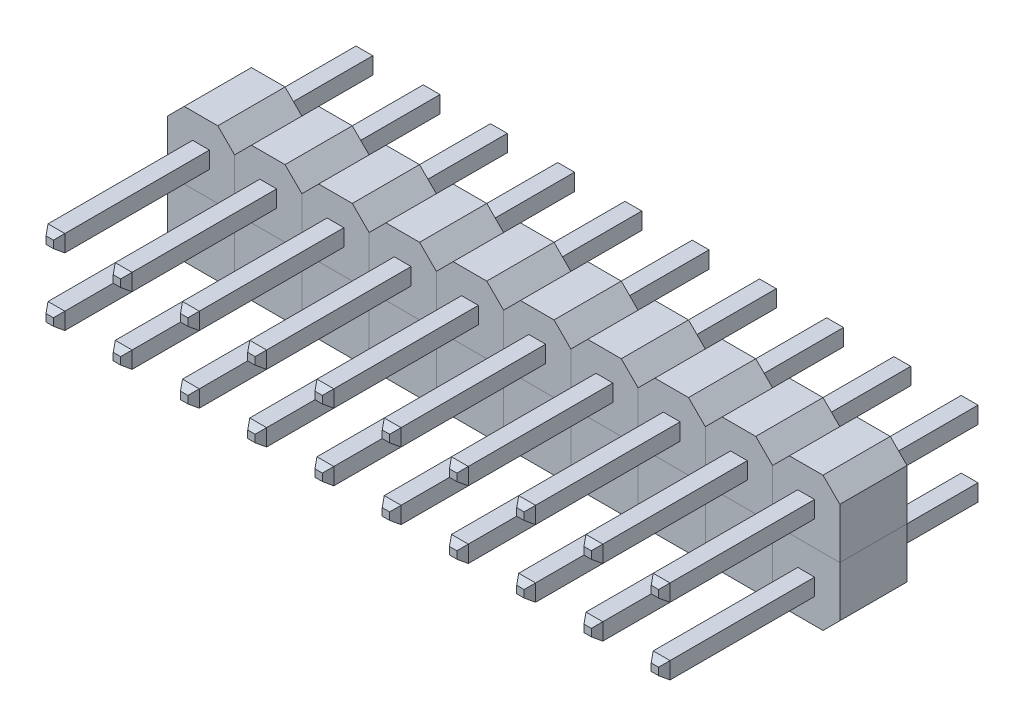
from build123d import *
from OCP.BRepFilletAPI import BRepFilletAPI_MakeChamfer

# Parameters (mm, degrees)
SKETCH_1_W               = 2
SKETCH_1_H               = 2
EXTRUDE_1_DEPTH          = 2
CHAMFER_1_SIZE           = 0.5
PATTERN_LINEAR_2_COUNT   = 10
PATTERN_LINEAR_2_PITCH   = 2
EXTRUDE_2_DEPTH          = 4.5
EXTRUDE_2_DEPTH_BACK     = 5
SKETCH_2_W               = 0.5
SKETCH_2_H               = 0.5
CHAMFER_2_SIZE           = 0.2
CHAMFER_2_SIZE2          = 0.140041508
PATTERN_LINEAR_3_COUNT   = 10
PATTERN_LINEAR_3_PITCH   = 2
PATTERN_LINEAR_3_2_COUNT = 2
PATTERN_LINEAR_3_2_PITCH = 2


with BuildPart() as part:
    # Эскиз1 → Бобышка-Вытянуть1 (new body)
    with BuildSketch(Plane.XY):
        with Locations((9, 1)):
            Rectangle(SKETCH_1_W, SKETCH_1_H)
    extrude(amount=EXTRUDE_1_DEPTH)

    # Фаска1
    chamfer_1_edges = [part.edges().sort_by_distance(p)[0] for p in [
        (8, 2, 1),
        (10, 2, 1),
    ]]
    chamfer(chamfer_1_edges, length=CHAMFER_1_SIZE)


with BuildPart() as pattern_linear_2_1:
    # Линейный массив2: pattern copy
    add(part.part.moved(Location(Vector(-1, 0, 0) * (1 * PATTERN_LINEAR_2_PITCH))))


with BuildPart() as pattern_linear_2_2:
    # Линейный массив2: pattern copy
    add(part.part.moved(Location(Vector(-1, 0, 0) * (2 * PATTERN_LINEAR_2_PITCH))))


with BuildPart() as pattern_linear_2_3:
    # Линейный массив2: pattern copy
    add(part.part.moved(Location(Vector(-1, 0, 0) * (3 * PATTERN_LINEAR_2_PITCH))))


with BuildPart() as pattern_linear_2_4:
    # Линейный массив2: pattern copy
    add(part.part.moved(Location(Vector(-1, 0, 0) * (4 * PATTERN_LINEAR_2_PITCH))))


with BuildPart() as pattern_linear_2_5:
    # Линейный массив2: pattern copy
    add(part.part.moved(Location(Vector(-1, 0, 0) * (5 * PATTERN_LINEAR_2_PITCH))))


with BuildPart() as pattern_linear_2_6:
    # Линейный массив2: pattern copy
    add(part.part.moved(Location(Vector(-1, 0, 0) * (6 * PATTERN_LINEAR_2_PITCH))))


with BuildPart() as pattern_linear_2_7:
    # Линейный массив2: pattern copy
    add(part.part.moved(Location(Vector(-1, 0, 0) * (7 * PATTERN_LINEAR_2_PITCH))))


with BuildPart() as pattern_linear_2_8:
    # Линейный массив2: pattern copy
    add(part.part.moved(Location(Vector(-1, 0, 0) * (8 * PATTERN_LINEAR_2_PITCH))))


with BuildPart() as pattern_linear_2_9:
    # Линейный массив2: pattern copy
    add(part.part.moved(Location(Vector(-1, 0, 0) * (9 * PATTERN_LINEAR_2_PITCH))))


with BuildPart() as body_11:
    # Зеркальное отражение1: mirrored copy
    add(part.part.mirror(Plane(origin=(8, 0, 2), x_dir=(0, 0, 1), z_dir=(0, 1, 0))))


with BuildPart() as body_12:
    # Mirror 1 2: mirrored copy
    add(pattern_linear_2_5.part.mirror(Plane(origin=(8, 0, 2), x_dir=(0, 0, 1), z_dir=(0, 1, 0))))


with BuildPart() as body_13:
    # Mirror 1 3: mirrored copy
    add(pattern_linear_2_4.part.mirror(Plane(origin=(8, 0, 2), x_dir=(0, 0, 1), z_dir=(0, 1, 0))))


with BuildPart() as body_14:
    # Mirror 1 4: mirrored copy
    add(pattern_linear_2_9.part.mirror(Plane(origin=(8, 0, 2), x_dir=(0, 0, 1), z_dir=(0, 1, 0))))


with BuildPart() as body_15:
    # Mirror 1 5: mirrored copy
    add(pattern_linear_2_3.part.mirror(Plane(origin=(8, 0, 2), x_dir=(0, 0, 1), z_dir=(0, 1, 0))))


with BuildPart() as body_16:
    # Mirror 1 6: mirrored copy
    add(pattern_linear_2_8.part.mirror(Plane(origin=(8, 0, 2), x_dir=(0, 0, 1), z_dir=(0, 1, 0))))


with BuildPart() as body_17:
    # Mirror 1 7: mirrored copy
    add(pattern_linear_2_2.part.mirror(Plane(origin=(8, 0, 2), x_dir=(0, 0, 1), z_dir=(0, 1, 0))))


with BuildPart() as body_18:
    # Mirror 1 8: mirrored copy
    add(pattern_linear_2_7.part.mirror(Plane(origin=(8, 0, 2), x_dir=(0, 0, 1), z_dir=(0, 1, 0))))


with BuildPart() as body_19:
    # Mirror 1 9: mirrored copy
    add(pattern_linear_2_1.part.mirror(Plane(origin=(8, 0, 2), x_dir=(0, 0, 1), z_dir=(0, 1, 0))))


with BuildPart() as body_20:
    # Mirror 1 10: mirrored copy
    add(pattern_linear_2_6.part.mirror(Plane(origin=(8, 0, 2), x_dir=(0, 0, 1), z_dir=(0, 1, 0))))


with BuildPart() as body_21:
    # Эскиз2 → Бобышка-Вытянуть2 (new, two sides: drawn at the far end of the back side and taken through both)
    with BuildSketch(Plane.XY.offset(2).offset(-EXTRUDE_2_DEPTH_BACK)):
        with Locations((9, 1)):
            Rectangle(SKETCH_2_W, SKETCH_2_H)
    extrude(amount=EXTRUDE_2_DEPTH + EXTRUDE_2_DEPTH_BACK)

    # Фаска2: one chamfer whose edges measure the first distance from different faces: ONE call of the kernel's chamfer builder (chamfer() names one face for all edges)
    chamfer_2_edges_1 = [body_21.edges().sort_by_distance(p)[0] for p in [
        (9.25, 1, 6.5),
    ]]
    chamfer_2_side_1 = [body_21.faces().sort_by_distance(p)[0] for p in [
        (9.25, 1, 1.75),
    ]]
    chamfer_2_edges_2 = [body_21.edges().sort_by_distance(p)[0] for p in [
        (8.75, 1, -3),
        (9, 0.75, -3),
        (9.25, 1, -3),
        (9, 1.25, -3),
    ]]
    chamfer_2_side_2 = [body_21.faces().sort_by_distance(p)[0] for p in [
        (9, 1, -3),
    ]]
    chamfer_2_edges_3 = [body_21.edges().sort_by_distance(p)[0] for p in [
        (9, 1.25, 6.5),
    ]]
    chamfer_2_side_3 = [body_21.faces().sort_by_distance(p)[0] for p in [
        (9, 1.25, 1.75),
    ]]
    chamfer_2_edges_4 = [body_21.edges().sort_by_distance(p)[0] for p in [
        (8.75, 1, 6.5),
    ]]
    chamfer_2_side_4 = [body_21.faces().sort_by_distance(p)[0] for p in [
        (8.75, 1, 1.75),
    ]]
    chamfer_2_edges_5 = [body_21.edges().sort_by_distance(p)[0] for p in [
        (9, 0.75, 6.5),
    ]]
    chamfer_2_side_5 = [body_21.faces().sort_by_distance(p)[0] for p in [
        (9, 0.75, 1.75),
    ]]
    chamfer_2 = BRepFilletAPI_MakeChamfer(body_21.part.solid().wrapped)
    for e in chamfer_2_edges_1:
        chamfer_2.Add(CHAMFER_2_SIZE, CHAMFER_2_SIZE2, e.wrapped, chamfer_2_side_1[0].wrapped)  # the first distance lies on this face
    for e in chamfer_2_edges_2:
        chamfer_2.Add(CHAMFER_2_SIZE, CHAMFER_2_SIZE2, e.wrapped, chamfer_2_side_2[0].wrapped)  # the first distance lies on this face
    for e in chamfer_2_edges_3:
        chamfer_2.Add(CHAMFER_2_SIZE, CHAMFER_2_SIZE2, e.wrapped, chamfer_2_side_3[0].wrapped)  # the first distance lies on this face
    for e in chamfer_2_edges_4:
        chamfer_2.Add(CHAMFER_2_SIZE, CHAMFER_2_SIZE2, e.wrapped, chamfer_2_side_4[0].wrapped)  # the first distance lies on this face
    for e in chamfer_2_edges_5:
        chamfer_2.Add(CHAMFER_2_SIZE, CHAMFER_2_SIZE2, e.wrapped, chamfer_2_side_5[0].wrapped)  # the first distance lies on this face
    add(Compound.cast(chamfer_2.Shape()), mode=Mode.REPLACE)


with BuildPart() as pattern_linear_3_1:
    # Линейный массив3: pattern copy
    add(body_21.part.moved(Location(Vector(-1, 0, 0) * (1 * PATTERN_LINEAR_3_PITCH))))


with BuildPart() as pattern_linear_3_2:
    # Линейный массив3: pattern copy
    add(body_21.part.moved(Location(Vector(-1, 0, 0) * (2 * PATTERN_LINEAR_3_PITCH))))


with BuildPart() as pattern_linear_3_3:
    # Линейный массив3: pattern copy
    add(body_21.part.moved(Location(Vector(-1, 0, 0) * (3 * PATTERN_LINEAR_3_PITCH))))


with BuildPart() as pattern_linear_3_4:
    # Линейный массив3: pattern copy
    add(body_21.part.moved(Location(Vector(-1, 0, 0) * (4 * PATTERN_LINEAR_3_PITCH))))


with BuildPart() as pattern_linear_3_5:
    # Линейный массив3: pattern copy
    add(body_21.part.moved(Location(Vector(-1, 0, 0) * (5 * PATTERN_LINEAR_3_PITCH))))


with BuildPart() as pattern_linear_3_6:
    # Линейный массив3: pattern copy
    add(body_21.part.moved(Location(Vector(-1, 0, 0) * (6 * PATTERN_LINEAR_3_PITCH))))


with BuildPart() as pattern_linear_3_7:
    # Линейный массив3: pattern copy
    add(body_21.part.moved(Location(Vector(-1, 0, 0) * (7 * PATTERN_LINEAR_3_PITCH))))


with BuildPart() as pattern_linear_3_8:
    # Линейный массив3: pattern copy
    add(body_21.part.moved(Location(Vector(-1, 0, 0) * (8 * PATTERN_LINEAR_3_PITCH))))


with BuildPart() as pattern_linear_3_9:
    # Линейный массив3: pattern copy
    add(body_21.part.moved(Location(Vector(-1, 0, 0) * (9 * PATTERN_LINEAR_3_PITCH))))


with BuildPart() as pattern_linear_3_2_1:
    # Pattern Linear 3 2: pattern copy
    add(body_21.part.moved(Location(Vector(0, -1, 0) * (1 * PATTERN_LINEAR_3_2_PITCH))))


with BuildPart() as pattern_linear_3_2_2:
    # Pattern Linear 3 2: pattern copy
    add(pattern_linear_3_1.part.moved(Location(Vector(0, -1, 0) * (1 * PATTERN_LINEAR_3_2_PITCH))))


with BuildPart() as pattern_linear_3_2_3:
    # Pattern Linear 3 2: pattern copy
    add(pattern_linear_3_2.part.moved(Location(Vector(0, -1, 0) * (1 * PATTERN_LINEAR_3_2_PITCH))))


with BuildPart() as pattern_linear_3_2_4:
    # Pattern Linear 3 2: pattern copy
    add(pattern_linear_3_3.part.moved(Location(Vector(0, -1, 0) * (1 * PATTERN_LINEAR_3_2_PITCH))))


with BuildPart() as pattern_linear_3_2_5:
    # Pattern Linear 3 2: pattern copy
    add(pattern_linear_3_4.part.moved(Location(Vector(0, -1, 0) * (1 * PATTERN_LINEAR_3_2_PITCH))))


with BuildPart() as pattern_linear_3_2_6:
    # Pattern Linear 3 2: pattern copy
    add(pattern_linear_3_5.part.moved(Location(Vector(0, -1, 0) * (1 * PATTERN_LINEAR_3_2_PITCH))))


with BuildPart() as pattern_linear_3_2_7:
    # Pattern Linear 3 2: pattern copy
    add(pattern_linear_3_6.part.moved(Location(Vector(0, -1, 0) * (1 * PATTERN_LINEAR_3_2_PITCH))))


with BuildPart() as pattern_linear_3_2_8:
    # Pattern Linear 3 2: pattern copy
    add(pattern_linear_3_7.part.moved(Location(Vector(0, -1, 0) * (1 * PATTERN_LINEAR_3_2_PITCH))))


with BuildPart() as pattern_linear_3_2_9:
    # Pattern Linear 3 2: pattern copy
    add(pattern_linear_3_8.part.moved(Location(Vector(0, -1, 0) * (1 * PATTERN_LINEAR_3_2_PITCH))))


with BuildPart() as pattern_linear_3_2_10:
    # Pattern Linear 3 2: pattern copy
    add(pattern_linear_3_9.part.moved(Location(Vector(0, -1, 0) * (1 * PATTERN_LINEAR_3_2_PITCH))))


solid = Compound([part.part, pattern_linear_2_1.part, pattern_linear_2_2.part, pattern_linear_2_3.part, pattern_linear_2_4.part, pattern_linear_2_5.part, pattern_linear_2_6.part, pattern_linear_2_7.part, pattern_linear_2_8.part, pattern_linear_2_9.part, body_11.part, body_12.part, body_13.part, body_14.part, body_15.part, body_16.part, body_17.part, body_18.part, body_19.part, body_20.part, body_21.part, pattern_linear_3_1.part, pattern_linear_3_2.part, pattern_linear_3_3.part, pattern_linear_3_4.part, pattern_linear_3_5.part, pattern_linear_3_6.part, pattern_linear_3_7.part, pattern_linear_3_8.part, pattern_linear_3_9.part, pattern_linear_3_2_1.part, pattern_linear_3_2_2.part, pattern_linear_3_2_3.part, pattern_linear_3_2_4.part, pattern_linear_3_2_5.part, pattern_linear_3_2_6.part, pattern_linear_3_2_7.part, pattern_linear_3_2_8.part, pattern_linear_3_2_9.part, pattern_linear_3_2_10.part])
